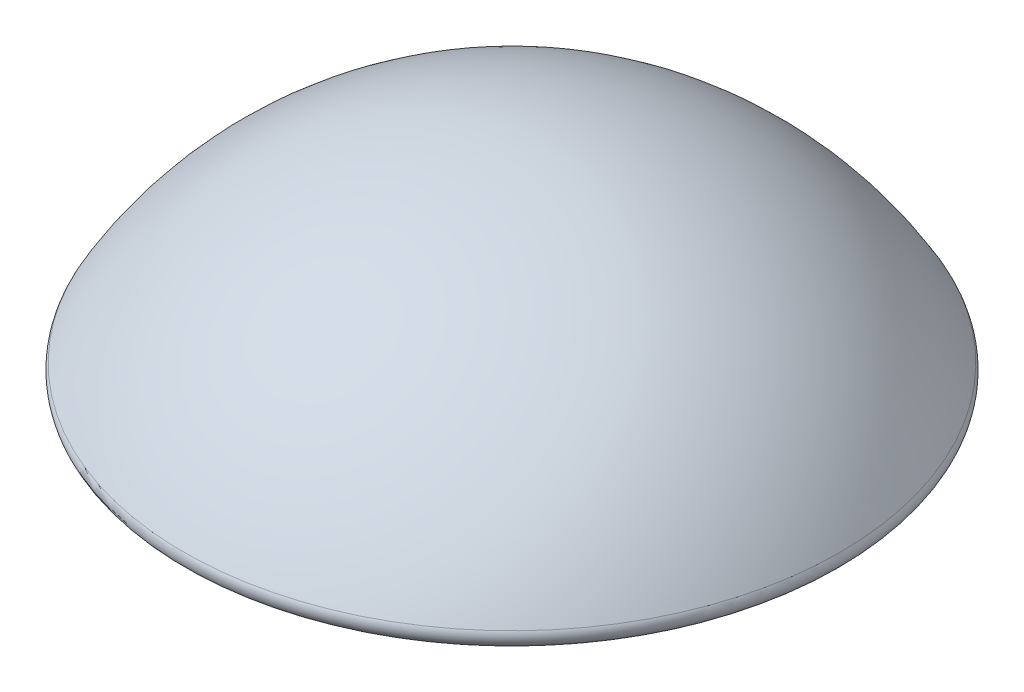
from build123d import *


with BuildPart() as part:
    # Sketch1 one side → Revolve1 (revolve)
    with BuildSketch(Plane.XY):
        with BuildLine():
            Line((0, 101.6), (0, 95.25))
            ThreePointArc((0, 95.25), (47.625, 82.48891971), (82.48891971, 47.625))
            ThreePointArc((82.48891971, 47.625), (86.826050367, 46.462869343), (87.988181024, 50.8))
            ThreePointArc((87.988181024, 50.8), (50.8, 87.988181024), (0, 101.6))
        make_face()
    revolve(axis=Axis((0, 0, 0), (0, -1, 0)))


solid = part.part
